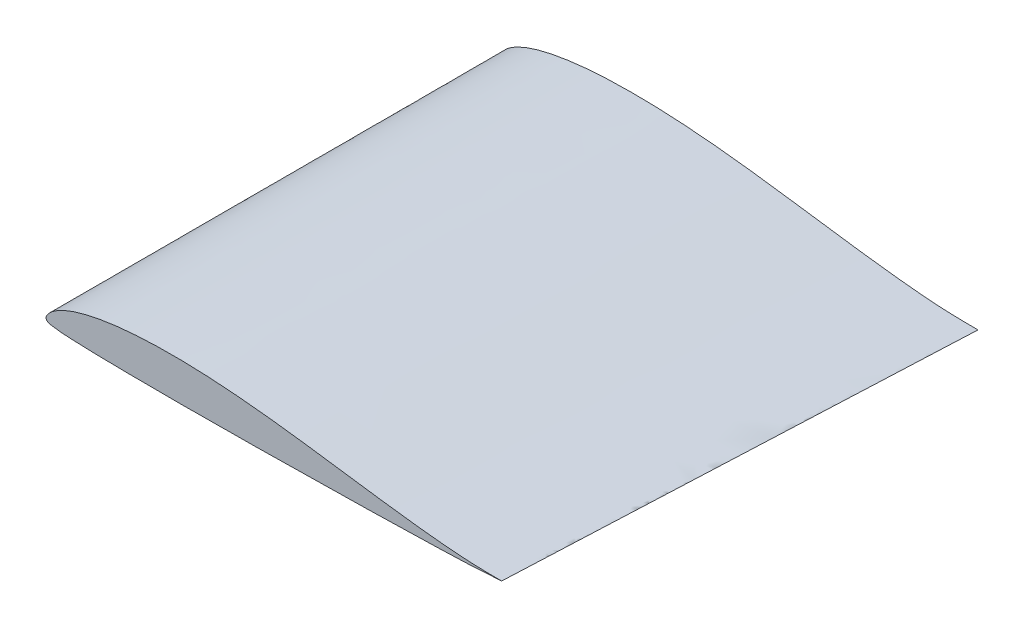
from build123d import *
from OCP.BRepFilletAPI import BRepFilletAPI_MakeChamfer

# Parameters (mm, degrees)
SKETCH4_R          = 2.6
SKETCH4_R_2        = 3.1
CUT_EXTRUDE1_DEPTH = 5.2
SKETCH5_W          = 9.9
SKETCH5_H          = 6
SKETCH5_W_2        = 9.5
CUT_EXTRUDE2_DEPTH = 70
FILLET3_R          = 2
CHAMFER1_SIZE      = 1
CHAMFER1_SIZE2     = 1.191753593
CUT_EXTRUDE3_DEPTH = 90.2
FILLET4_R          = 0.2
FILLET5_R          = 0.5
CHAMFER2_SIZE      = 1


with BuildPart() as part:
    # Sketch1 → Loft1 section 0
    with BuildSketch(Plane.XY):
        with BuildLine():
            add(Edge.make_bspline(
                [(115, 0), (114.999913382, 0.00327866), (114.222934603, -0.004567066), (113.418136575, 0.000318408), (111.44543546, 0.018706002), (108.999380922, 0.080565277), (105.780115155, 0.203144323), (101.978037922, 0.467320429), (97.63148646, 0.880990765), (92.843812566, 1.427373326), (87.693014802, 2.062174327), (82.26127365, 2.794917392), (76.628898252, 3.582200475), (70.875421432, 4.408274793), (65.069516957, 5.204495648), (59.272555938, 5.964988559), (53.535411353, 6.612069385), (47.902032041, 7.147901639), (42.420677472, 7.538059951), (37.125743857, 7.784294524), (32.060080889, 7.863888962), (27.260899934, 7.799703202), (22.764274035, 7.585443948), (18.606628598, 7.224009749), (14.819582747, 6.717397261), (11.43119341, 6.102885155), (8.463318021, 5.359495242), (5.929953708, 4.523167874), (3.840235227, 3.611431652), (2.203139301, 2.680524392), (0.997143498, 1.719388226), (0.306055902, 0.84473605), (-0.153897847, -0.016785493), (0.441131195, -0.783771302), (1.630250645, -0.976182526), (3.345026164, -1.247099953), (5.741349663, -1.385446358), (8.741002332, -1.531007587), (12.32356917, -1.613427576), (16.426146399, -1.711956772), (20.996614723, -1.764001286), (25.979915364, -1.804105207), (31.316658928, -1.826220598), (36.950031377, -1.811871436), (42.810070502, -1.783755804), (48.833365319, -1.730024981), (54.950109545, -1.67348399), (61.093513049, -1.595166549), (67.193299365, -1.488121719), (73.176935484, -1.397778739), (78.980025922, -1.271232402), (84.533413271, -1.152999753), (89.776869938, -1.037364871), (94.647010434, -0.905039683), (99.089599698, -0.778312882), (103.055602703, -0.646322839), (106.488295637, -0.529569147), (109.391284428, -0.370730171), (111.629000068, -0.244208643), (113.467096811, -0.099576309), (114.237158295, -0.036931621), (115.000086752, -0.003283716), (115, 0)],
                knots=[0, 0, 0, 0, 0.001545172, 0.006223608, 0.014035782, 0.024855049, 0.038644124, 0.055163693, 0.074045466, 0.094820373, 0.117222732, 0.140866367, 0.165395395, 0.190452399, 0.215710088, 0.240854358, 0.265734023, 0.290048364, 0.313714428, 0.336486101, 0.358292895, 0.378940292, 0.398278007, 0.416246563, 0.432660408, 0.447459903, 0.460566131, 0.472021733, 0.481783695, 0.489844359, 0.496307136, 0.50126117, 0.504695153, 0.507385543, 0.512190444, 0.519692984, 0.529980259, 0.542956454, 0.558414131, 0.576101982, 0.595804604, 0.61726601, 0.64027206, 0.66452271, 0.689803764, 0.7157292, 0.742084221, 0.768568973, 0.794840399, 0.820639753, 0.845625339, 0.869581038, 0.892163588, 0.913159587, 0.932310678, 0.94940252, 0.964220925, 0.976641917, 0.986532119, 0.993892864, 0.998452446, 1, 1, 1, 1], degree=3))
        make_face()
    # Sketch2 → Loft1 section 1
    with BuildSketch(Plane.XY.offset(110)):
        with BuildLine():
            add(Edge.make_bspline(
                [(110, 0), (110.000464145, 0.002638021), (109.253557002, -0.006421882), (108.485306247, 0.00202473), (106.599515685, 0.014018922), (104.259903283, 0.071192731), (101.178986874, 0.200889618), (97.542661477, 0.451950761), (93.384633146, 0.843539364), (88.805204424, 1.362015696), (83.880374164, 1.978555721), (78.68657223, 2.677523385), (73.299477431, 3.430735281), (67.795235431, 4.215247142), (62.241233075, 4.984660857), (56.695525551, 5.697469803), (51.207787306, 6.322755672), (45.821489693, 6.833626486), (40.577824462, 7.211562863), (35.514283248, 7.444282984), (30.668486135, 7.527509184), (26.076763803, 7.463490784), (21.77566696, 7.255221358), (17.798933432, 6.909184212), (14.177047879, 6.430194992), (10.935139134, 5.831964767), (8.094704102, 5.122344568), (5.670248347, 4.327180111), (3.669790047, 3.460558372), (2.10909167, 2.56151381), (0.952680778, 1.647952784), (0.292493833, 0.810328248), (-0.144477468, -0.013443729), (0.421457768, -0.751792674), (1.561430619, -0.927732015), (3.196411713, -1.199647616), (5.489901797, -1.325203312), (8.359384575, -1.457341268), (11.786506209, -1.55318322), (15.712038629, -1.632817261), (20.085890157, -1.693490267), (24.85332264, -1.730533844), (29.958495668, -1.745317698), (35.344133299, -1.736641885), (40.949025669, -1.70754651), (46.710109342, -1.660092686), (52.562107594, -1.595708584), (58.438334584, -1.519615465), (64.272360823, -1.429130605), (69.997133878, -1.329443239), (75.548112692, -1.222377083), (80.861507128, -1.10840335), (85.876724326, -0.990587124), (90.536246874, -0.869398239), (94.784781842, -0.746694986), (98.577741113, -0.621781265), (101.858350076, -0.496229968), (104.635869759, -0.366297292), (106.773720091, -0.224338993), (108.53252638, -0.099668194), (109.269457647, -0.031974616), (109.999539654, -0.002616432), (110, 0)],
                knots=[0, 0, 0, 0, 0.001564721, 0.006239121, 0.014018617, 0.024861007, 0.038659987, 0.055174427, 0.074046407, 0.094837256, 0.117226118, 0.14085626, 0.165386109, 0.19045125, 0.215702393, 0.240866612, 0.265718976, 0.290051983, 0.313696202, 0.33648442, 0.358279861, 0.378929437, 0.398292398, 0.416235766, 0.432650472, 0.447455618, 0.460592079, 0.472030369, 0.48177877, 0.489853088, 0.496315276, 0.501246195, 0.504684904, 0.507403743, 0.512183233, 0.519672773, 0.529968131, 0.54294809, 0.558399818, 0.576099165, 0.595810572, 0.617282889, 0.64027984, 0.664535393, 0.689783385, 0.715732831, 0.742092653, 0.768566703, 0.794844175, 0.820638712, 0.845644257, 0.86958445, 0.892182833, 0.913177877, 0.932327829, 0.949410904, 0.964230176, 0.976629486, 0.986536787, 0.993881551, 0.998448084, 1, 1, 1, 1], degree=3))
        make_face()
    loft()

    # Sketch4 → Cut-Extrude1 (cut)
    with BuildSketch(Plane(origin=(0, 0, 0), x_dir=(-1, 0, 0), z_dir=(0, 0, -1))):
        with Locations((-10.5, 2)):
            Circle(SKETCH4_R)
        with Locations((-57, 2.1)):
            Circle(SKETCH4_R_2)
    extrude(amount=-CUT_EXTRUDE1_DEPTH, mode=Mode.SUBTRACT)

    # Sketch5 → Cut-Extrude2 (cut)
    with BuildSketch(Plane(origin=(0, 0, 0), x_dir=(-1, 0, 0), z_dir=(0, 0, -1))):
        with Locations((-21, 2.8)):
            Rectangle(SKETCH5_W, SKETCH5_H)
        with Locations((-46, 3)):
            Rectangle(SKETCH5_W_2, SKETCH5_H)
    extrude(amount=-CUT_EXTRUDE2_DEPTH, mode=Mode.SUBTRACT)

    # Fillet3
    fillet3_edges = [part.edges().sort_by_distance(p)[0] for p in [
        (16.05, 5.8, 35),
        (25.95, 5.8, 35),
        (41.25, 6, 35),
        (50.75, 6, 35),
    ]]
    fillet(fillet3_edges, radius=FILLET3_R)

    # Chamfer1: one chamfer whose edges measure the first distance from different faces: ONE call of the kernel's chamfer builder (chamfer() names one face for all edges)
    chamfer1_edges_1 = [part.edges().sort_by_distance(p)[0] for p in [
        (16.05, -0.2, 35),
    ]]
    chamfer1_side_1 = [part.faces().sort_by_distance(p)[0] for p in [
        (21, -0.2, 35),
    ]]
    chamfer1_edges_2 = [part.edges().sort_by_distance(p)[0] for p in [
        (25.95, -0.2, 35),
    ]]
    chamfer1_side_2 = [part.faces().sort_by_distance(p)[0] for p in [
        (25.95, 1.8, 35),
    ]]
    chamfer1_edges_3 = [part.edges().sort_by_distance(p)[0] for p in [
        (41.25, 0, 35),
    ]]
    chamfer1_side_3 = [part.faces().sort_by_distance(p)[0] for p in [
        (46, 0, 35),
    ]]
    chamfer1_edges_4 = [part.edges().sort_by_distance(p)[0] for p in [
        (50.75, 0, 35),
    ]]
    chamfer1_side_4 = [part.faces().sort_by_distance(p)[0] for p in [
        (50.75, 2, 35),
    ]]
    chamfer1 = BRepFilletAPI_MakeChamfer(part.part.solid().wrapped)
    for e in chamfer1_edges_1:
        chamfer1.Add(CHAMFER1_SIZE, CHAMFER1_SIZE2, e.wrapped, chamfer1_side_1[0].wrapped)  # the first distance lies on this face
    for e in chamfer1_edges_2:
        chamfer1.Add(CHAMFER1_SIZE, CHAMFER1_SIZE2, e.wrapped, chamfer1_side_2[0].wrapped)  # the first distance lies on this face
    for e in chamfer1_edges_3:
        chamfer1.Add(CHAMFER1_SIZE, CHAMFER1_SIZE2, e.wrapped, chamfer1_side_3[0].wrapped)  # the first distance lies on this face
    for e in chamfer1_edges_4:
        chamfer1.Add(CHAMFER1_SIZE, CHAMFER1_SIZE2, e.wrapped, chamfer1_side_4[0].wrapped)  # the first distance lies on this face
    add(Compound.cast(chamfer1.Shape()), mode=Mode.REPLACE)

    # Sketch6 → Cut-Extrude3 (cut)
    with BuildSketch(Plane(origin=(0, 0, 0), x_dir=(-1, 0, 0), z_dir=(0, 0, -1))):
        Polygon((-63.462295223, 3.793174257), (-63.462295223, 0.235158592), (-89.865630471, 0.235158592), align=None)
    extrude(amount=-CUT_EXTRUDE3_DEPTH, mode=Mode.SUBTRACT)

    # Fillet4
    fillet4_edges = [part.edges().sort_by_distance(p)[0] for p in [
        (89.865630471, 0.235158592, 45.1),
    ]]
    fillet(fillet4_edges, radius=FILLET4_R)

    # Fillet5
    fillet5_edges = [part.edges().sort_by_distance(p)[0] for p in [
        (63.462295223, 3.793174257, 45.1),
    ]]
    fillet(fillet5_edges, radius=FILLET5_R)

    # Chamfer2
    chamfer2_edges = [part.edges().sort_by_distance(p)[0] for p in [
        (63.462295223, 0.235158592, 45.1),
    ]]
    chamfer(chamfer2_edges, length=CHAMFER2_SIZE)


solid = part.part
